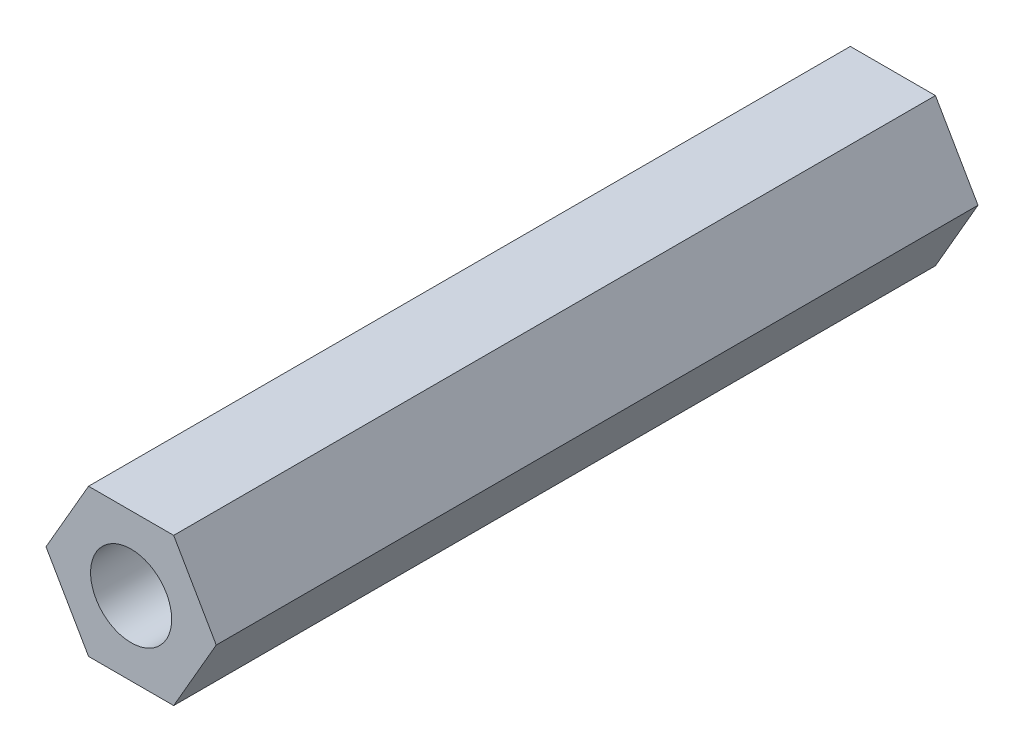
from build123d import *

# Parameters (mm, degrees)
SKETCH1_R           = 1.65
BOSS_EXTRUDE1_DEPTH = 31


with BuildPart() as part:
    # Sketch1 → Boss-Extrude1 (new body)
    with BuildSketch(Plane.XY):
        Polygon((1.732050808, 3), (-1.732050808, 3), (-3.464101615, 0), (-1.732050808, -3), (1.732050808, -3), (3.464101615, 0), align=None)
        Circle(SKETCH1_R, mode=Mode.SUBTRACT)
    extrude(amount=BOSS_EXTRUDE1_DEPTH)


solid = part.part
